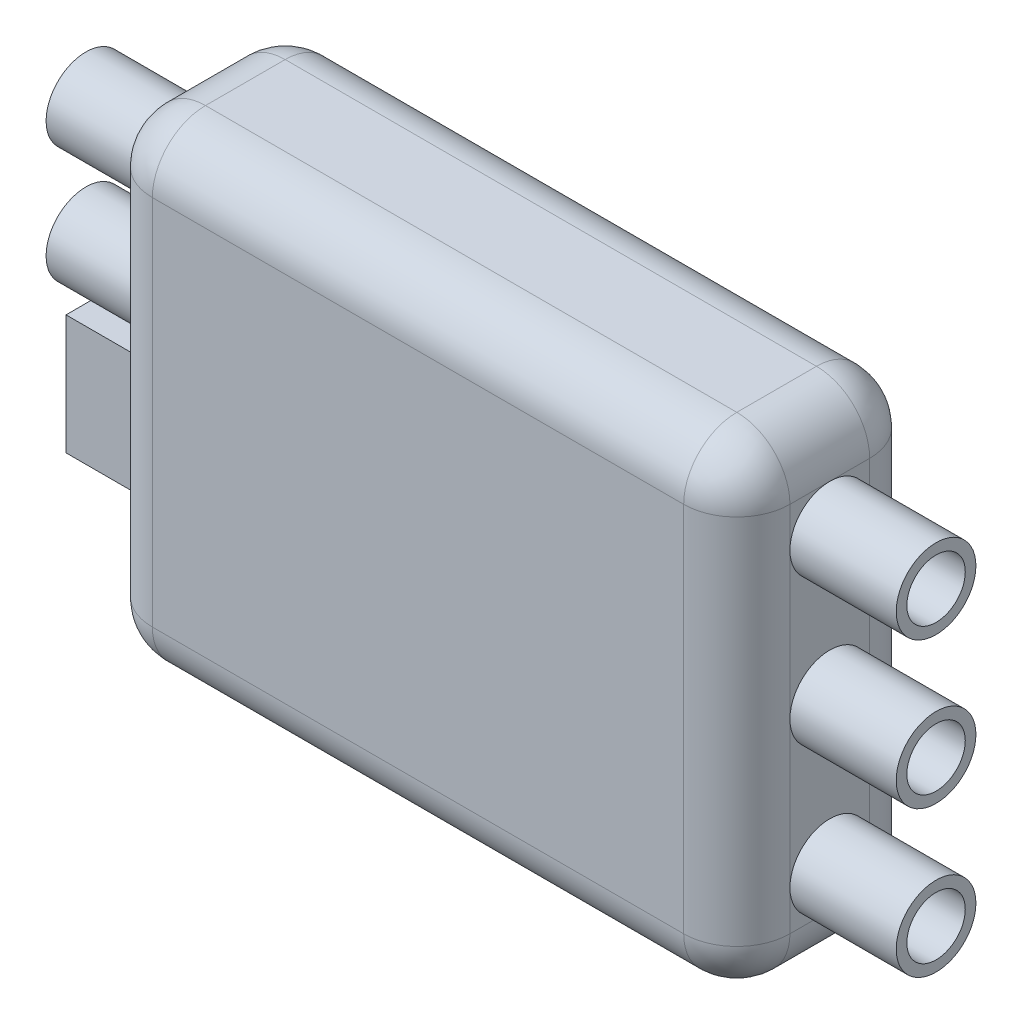
from build123d import *

# Parameters (mm, degrees)
BOSS_EXTRUDE1_DEPTH = 7
FILLET1_R           = 2
SKETCH3_R           = 1.5
SKETCH3_R_2         = 1.1
BOSS_EXTRUDE2_DEPTH = 4
BOSS_EXTRUDE3_START = 4
SKETCH4_R           = 1.5
SKETCH4_R_2         = 1.1
SKETCH4_W           = 1.5
SKETCH4_H           = 4.5
BOSS_EXTRUDE3_DEPTH = 4


with BuildPart() as part:
    # Sketch1 → Boss-Extrude1 (new body)
    with BuildSketch(Plane.XY):
        with BuildLine():
            Line((-10, -9), (10, -9))
            ThreePointArc((10, -9), (11.414213562, -8.414213562), (12, -7))
            Line((12, -7), (12, 7))
            ThreePointArc((12, 7), (11.414213562, 8.414213562), (10, 9))
            Line((10, 9), (-10, 9))
            ThreePointArc((-10, 9), (-11.414213562, 8.414213562), (-12, 7))
            Line((-12, 7), (-12, -7))
            ThreePointArc((-12, -7), (-11.414213562, -8.414213562), (-10, -9))
        make_face()
    extrude(amount=BOSS_EXTRUDE1_DEPTH)

    # Fillet1
    fillet1_edges = [part.edges().sort_by_distance(p)[0] for p in [
        (12, 0, 0),
        (11.414213562, -8.414213562, 0),
        (0, -9, 0),
        (-11.414213562, -8.414213562, 0),
        (11.414213562, -8.414213562, 7),
        (12, 0, 7),
        (11.414213562, 8.414213562, 7),
        (0, 9, 7),
        (-11.414213562, 8.414213562, 7),
        (-12, 0, 7),
        (-11.414213562, -8.414213562, 7),
        (-12, 0, 0),
        (0, -9, 7),
        (-11.414213562, 8.414213562, 0),
        (0, 9, 0),
        (11.414213562, 8.414213562, 0),
    ]]
    fillet(fillet1_edges, radius=FILLET1_R)

    # Sketch3 → Boss-Extrude2 (add)
    # profile 1 of 3: a face of its own
    with BuildSketch(Plane(origin=(12, 0, 0), x_dir=(0, 0, -1), z_dir=(1, 0, 0))):
        with Locations((-3.5, 0)):
            Circle(SKETCH3_R)
        with Locations((-3.5, 0)):
            Circle(SKETCH3_R_2, mode=Mode.SUBTRACT)
    # profile 2 of 3: a face of its own
    with BuildSketch(Plane(origin=(12, 0, 0), x_dir=(0, 0, -1), z_dir=(1, 0, 0))):
        with Locations((-3.5, 5.5)):
            Circle(SKETCH3_R)
        with Locations((-3.5, 5.5)):
            Circle(SKETCH3_R_2, mode=Mode.SUBTRACT)
    # profile 3 of 3: a face of its own
    with BuildSketch(Plane(origin=(12, 0, 0), x_dir=(0, 0, -1), z_dir=(1, 0, 0))):
        with Locations((-3.5, -5.5)):
            Circle(SKETCH3_R)
        with Locations((-3.5, -5.5)):
            Circle(SKETCH3_R_2, mode=Mode.SUBTRACT)
    extrude(amount=BOSS_EXTRUDE2_DEPTH)

    # Sketch4 → Boss-Extrude3 (add)
    # profile 1 of 3: a face of its own
    with BuildSketch(Plane.ZY.offset(12).offset(BOSS_EXTRUDE3_START)):
        with Locations(Location((3.5, 5.5, 0), (0, 0, 180))):
            Circle(SKETCH4_R)
        with Locations(Location((3.5, 5.5, 0), (0, 0, 180))):
            Circle(SKETCH4_R_2, mode=Mode.SUBTRACT)
    # profile 2 of 3: a face of its own
    with BuildSketch(Plane.ZY.offset(12).offset(BOSS_EXTRUDE3_START)):
        with Locations((3.5, 1.1)):
            Circle(SKETCH4_R)
        with Locations((3.5, 1.1)):
            Circle(SKETCH4_R_2, mode=Mode.SUBTRACT)
    # profile 3 of 3: a face of its own
    with BuildSketch(Plane.ZY.offset(12).offset(BOSS_EXTRUDE3_START)):
        with Locations((3.5, -3.447939239)):
            Rectangle(SKETCH4_W, SKETCH4_H)
    extrude(amount=-BOSS_EXTRUDE3_DEPTH)


solid = part.part
